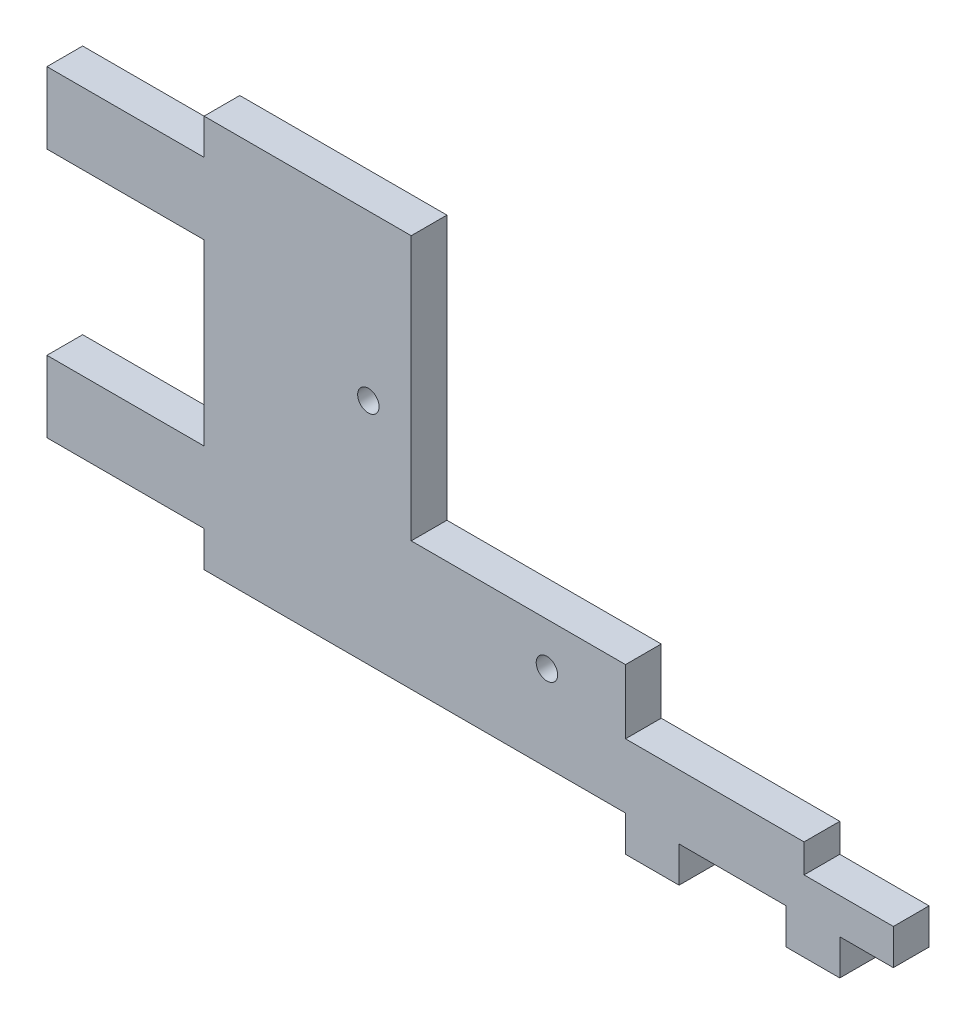
from build123d import *

# Parameters (mm, degrees)
ESQUISSE1_R        = 1.5
BOSS_EXTRU_1_DEPTH = 5
BOSS_EXTRU_2_DEPTH = 5


with BuildPart() as part:
    # Esquisse1 → Boss.-Extru.1 (new body)
    with BuildSketch(Plane.XY):
        Polygon((0, 0), (37, 0), (37, 18), (12, 18), (12, 55), (0, 55), align=None)
        with Locations((6, 32)):
            Circle(ESQUISSE1_R, mode=Mode.SUBTRACT)
        with Locations((31, 12)):
            Circle(ESQUISSE1_R, mode=Mode.SUBTRACT)
    extrude(amount=BOSS_EXTRU_1_DEPTH)

    # Esquisse2 → Boss.-Extru.2 (add)
    with BuildSketch(Plane.XY.offset(5)):
        Polygon((37, 0), (42, 0), (42, -5), (49.5, -5), (49.5, 0), (64.5, 0), (64.5, -5), (72, -5), (72, 0), (79.5, 0), (79.5, 5), (67, 5), (67, 9), (42, 9), (42, 18), (37, 18), align=None)
        Polygon((0, 0), (-17, 0), (-17, 5), (-39, 5), (-39, 15), (-17, 15), (-17, 40), (-39, 40), (-39, 50), (-17, 50), (-17, 55), (0, 55), align=None)
    extrude(amount=-BOSS_EXTRU_2_DEPTH)


solid = part.part
